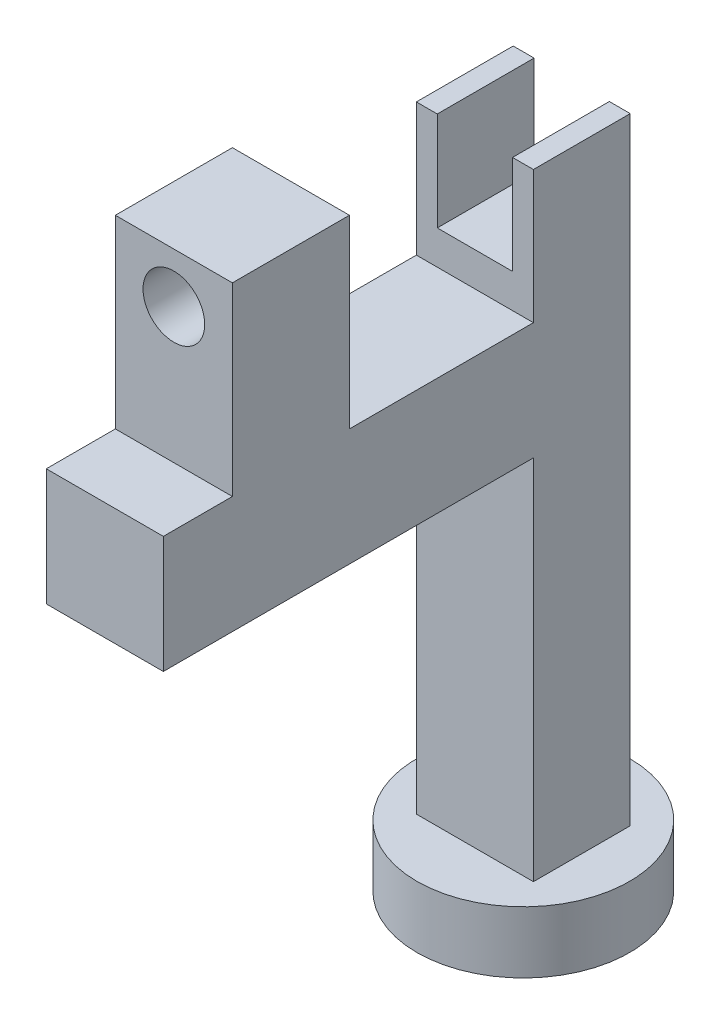
from build123d import *

# Parameters (mm, degrees)
BOSS_EXTRUDE1_DEPTH = 15.7
SKETCH2_R           = 17.25
BOSS_EXTRUDE2_DEPTH = 10
SKETCH4_R           = 0.8
CUT_EXTRUDE1_DEPTH  = 2
SKETCH5_W           = 18.977777778
SKETCH5_H           = 18.977777778
BOSS_EXTRUDE3_DEPTH = 60
SKETCH6_W           = 18.977777778
SKETCH6_H           = 18.977777778
BOSS_EXTRUDE4_DEPTH = 30
CUT_EXTRUDE3_REACH  = 127.825
SKETCH7_R           = 5


with BuildPart() as part:
    # Sketch1 → Boss-Extrude1 (new body)
    with BuildSketch(Plane.XY):
        Polygon((0, 0), (0, -100), (-18.977777778, -100), (-18.977777778, 0), (-15.588888889, 0), (-15.588888889, -16), (-3.388888889, -16), (-3.388888889, 0), align=None)
    extrude(amount=BOSS_EXTRUDE1_DEPTH)

    # Sketch2 → Boss-Extrude2 (add)
    with BuildSketch(Plane.XZ.offset(100)):
        with Locations(Location((-9.488888889, 7.85, 0), (0, 0, 270))):
            Circle(SKETCH2_R)
    extrude(amount=BOSS_EXTRUDE2_DEPTH)

    # Sketch4 → Cut-Extrude1 (cut)
    with BuildSketch(Plane.XZ.offset(110)):
        with Locations(Location((-9.488888889, 7.85, 0), (0, 0, 270))):
            Circle(SKETCH4_R)
    extrude(amount=-CUT_EXTRUDE1_DEPTH, mode=Mode.SUBTRACT)

    # Sketch5 → Boss-Extrude3 (add)
    with BuildSketch(Plane.XY.offset(15.7)):
        with Locations((-9.488888889, -31)):
            Rectangle(SKETCH5_W, SKETCH5_H)
    extrude(amount=BOSS_EXTRUDE3_DEPTH)

    # Sketch6 → Boss-Extrude4 (add)
    with BuildSketch(Plane(origin=(0, -21.511111111, 0), x_dir=(1, 0, 0), z_dir=(0, 1, 0))):
        with Locations((-9.488888889, -55.01587184)):
            Rectangle(SKETCH6_W, SKETCH6_H)
    extrude(amount=BOSS_EXTRUDE4_DEPTH)

    # Sketch7 → Cut-Extrude3 (cut, up to next)
    with BuildSketch(Plane(origin=(0, 0, 45.526982951), x_dir=(-1, 0, 0), z_dir=(0, 0, -1)), mode=Mode.PRIVATE) as cut_extrude3_sk1:
        with Locations((9.488888889, 0.398888889)):
            Circle(SKETCH7_R)
    cut_extrude3_tool1 = extrude(cut_extrude3_sk1.sketch, amount=-CUT_EXTRUDE3_REACH, mode=Mode.PRIVATE) & part.part
    add(cut_extrude3_tool1.solids().sort_by_distance((-9.488889, 0.398889, 45.526983))[0], mode=Mode.SUBTRACT)


solid = part.part
